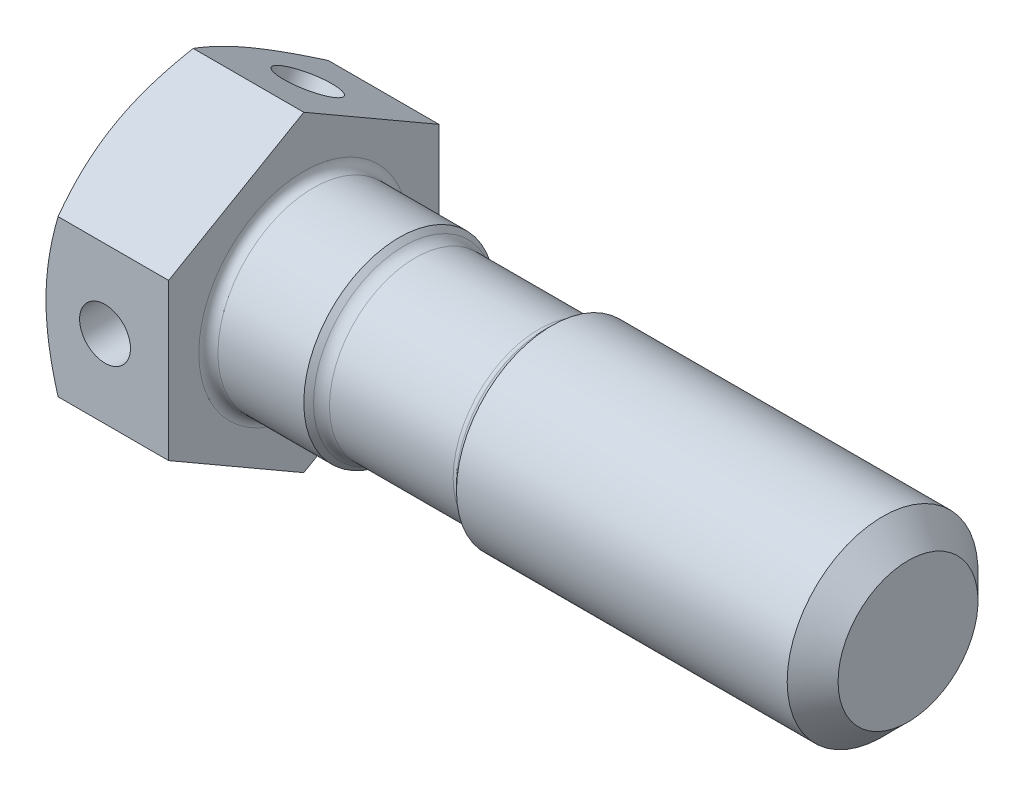
from build123d import *

# Parameters (mm, degrees)
EXTRUDE_1_DEPTH     = 8
SKETCH_3_OUTSIDE_W  = 198.604
SKETCH_3_OUTSIDE_H  = 201.234
SKETCH_3_OUTSIDE_R  = 8
CUT_EXTRUDE_1_DEPTH = 48.797315127
CUT_EXTRUDE_1_DRAFT = -60
FILLET_1_R          = 0.6
SKETCH_4_R          = 1.6
CUT_EXTRUDE_2_DEPTH = 43.770706486
SKETCH_5_R          = 1.75
CUT_EXTRUDE_3_DEPTH = 44.607147732


with BuildPart() as part:
    # Эскиз1 → Повернуть1 (revolve)
    with BuildSketch(Plane.XY, mode=Mode.PRIVATE) as revolve_1_sk:
        with BuildLine():
            Line((0, 0), (0, 6))
            Line((0, 6), (6, 6))
            Line((6, 6), (6.307106781, 5.692893219))
            ThreePointArc((6.307106781, 5.692893219), (6.63153013, 5.476120467), (7.014213562, 5.4))
            Line((7.014213562, 5.4), (14.792893219, 5.4))
            ThreePointArc((14.792893219, 5.4), (14.984234935, 5.438060234), (15.146446609, 5.546446609))
            Line((15.146446609, 5.546446609), (15.6, 6))
            Line((15.6, 6), (36.4, 6))
            Line((36.4, 6), (38, 4.4))
            Line((38, 4.4), (38, 0))
            Line((38, 0), (0, 0))
        make_face()
    revolve(revolve_1_sk.sketch.rotate(Axis((0, 0, 0), (1, 0, 0)), 90), axis=Axis((0, 0, 0), (1, 0, 0)))

    # Эскиз2 → Бобышка-Вытянуть1 (add)
    with BuildSketch(Plane.ZY):
        Polygon((0, -9.814954576), (8.5, -4.907477288), (8.5, 4.907477288), (0, 9.814954576), (-8.5, 4.907477288), (-8.5, -4.907477288), align=None)
    extrude(amount=EXTRUDE_1_DEPTH)


with BuildPart() as cut_extrude_1_tool:
    # Эскиз3 outside → Вырез-Вытянуть1 (with draft: the straight prism first)
    with BuildSketch(Plane.ZY.offset(8)):
        Rectangle(SKETCH_3_OUTSIDE_W, SKETCH_3_OUTSIDE_H)
        Circle(SKETCH_3_OUTSIDE_R, mode=Mode.SUBTRACT)
    extrude(amount=-CUT_EXTRUDE_1_DEPTH)
    # Вырез-Вытянуть1: the draft: its side faces are tilted about the plane it starts from
    cut_extrude_1_sides = [cut_extrude_1_tool.faces().sort_by_distance(p)[0] for p in [
        (16.398657563, -100.617, 0),
        (16.398657563, 0, 99.302),
        (16.398657563, 100.617, 0),
        (16.398657563, 0, -99.302),
        (16.398657563, 0, -8),
    ]]
    draft(cut_extrude_1_sides, Plane.ZY.offset(8), CUT_EXTRUDE_1_DRAFT)


with BuildPart() as part_1:
    add(part.part)

    # Вырез-Вытянуть1: cut by cut_extrude_1_tool
    add(cut_extrude_1_tool.part, mode=Mode.SUBTRACT)

    # Скругление1
    fillet_1_edges = [part_1.edges().sort_by_distance(p)[0] for p in [
        (0, 0, -6),
    ]]
    fillet(fillet_1_edges, radius=FILLET_1_R)

    # Эскиз4 → Вырез-Вытянуть2 (cut, through all)
    with BuildSketch(Plane.XY.offset(8.5)):
        with Locations((-4, 0)):
            Circle(SKETCH_4_R)
    extrude(amount=-CUT_EXTRUDE_2_DEPTH, mode=Mode.SUBTRACT)

    # Эскиз5 → Вырез-Вытянуть3 (cut, through all)
    with BuildSketch(Plane(origin=(0, -7.361215932, 4.25), x_dir=(1, 0, 0), z_dir=(0, -0.8660254037844384, 0.5000000000000003))):
        with Locations(Location((-4, 0, 0), (0, 0, 270))):
            Circle(SKETCH_5_R)
    extrude(amount=-CUT_EXTRUDE_3_DEPTH, mode=Mode.SUBTRACT)


solid = part_1.part
